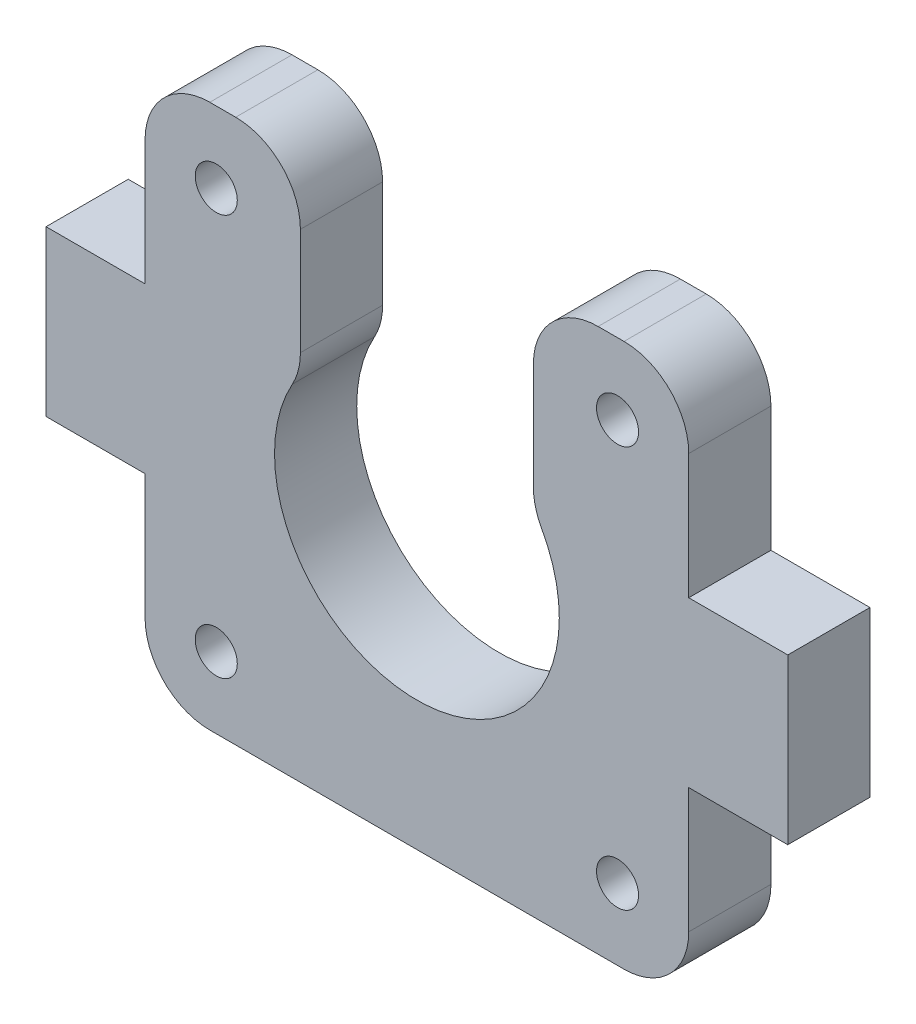
from build123d import *

# Parameters (mm, degrees)
SKETCH1_W                   = 57.3
SKETCH1_H                   = 42
BOSS_EXTRUDE1_DEPTH         = 6.35
TAP_DRILL_FOR_M3X0_5_TAP1_D = 3.25
CUT_EXTRUDE1_DEPTH          = 37.085246293
SKETCH5_W                   = 7.65
SKETCH5_H                   = 14.65
CUT_EXTRUDE2_DEPTH          = 37.085246293
FILLET1_R                   = 5


with BuildPart() as part:
    # Sketch1 → Boss-Extrude1 (new body)
    with BuildSketch(Plane.XY):
        Rectangle(SKETCH1_W, SKETCH1_H)
    extrude(amount=BOSS_EXTRUDE1_DEPTH)

    # Tap Drill for M3x0.5 Tap1 (through all)
    with Locations(Plane.XY.offset(6.35)):
        with Locations((15.5, 15.5), (15.5, -15.5), (-15.5, 15.5), (-15.5, -15.5)):
            Hole(TAP_DRILL_FOR_M3X0_5_TAP1_D / 2)

    # Sketch4 → Cut-Extrude1 (cut, through all)
    with BuildSketch(Plane.XY.offset(6.35)):
        with BuildLine():
            ThreePointArc((11, 0), (10.488088482, 3.31662479), (9, 6.32455532))
            Line((9, 6.32455532), (-9, 6.32455532))
            ThreePointArc((-9, 6.32455532), (-3.31662479, -10.488088482), (11, 0))
        make_face()
        with BuildLine():
            Line((-9, 6.32455532), (9, 6.32455532))
            ThreePointArc((9, 6.32455532), (0, 11), (-9, 6.32455532))
        make_face()
        with BuildLine():
            ThreePointArc((-9, 6.32455532), (0, 11), (9, 6.32455532))
            Line((9, 6.32455532), (9, 21))
            Line((9, 21), (-9, 21))
            Line((-9, 21), (-9, 6.32455532))
        make_face()
    extrude(amount=-CUT_EXTRUDE1_DEPTH, mode=Mode.SUBTRACT)

    # Sketch5 → Cut-Extrude2 (cut, through all)
    with BuildSketch(Plane.XY.offset(6.35)):
        with Locations((-24.825, 13.675)):
            Rectangle(SKETCH5_W, SKETCH5_H)
        with Locations((-24.825, -13.675)):
            Rectangle(SKETCH5_W, SKETCH5_H)
    cut_extrude2 = extrude(amount=-CUT_EXTRUDE2_DEPTH, mode=Mode.SUBTRACT)

    # Mirror1: Cut-Extrude2 across plane
    add(cut_extrude2.mirror(Plane(origin=(0, 0, 0), x_dir=(0, 0, 1), z_dir=(1, 0, 0))), mode=Mode.SUBTRACT)

    # Fillet1
    fillet1_edges = [part.edges().sort_by_distance(p)[0] for p in [
        (9, 6.32455532, 3.175),
        (-9, 6.32455532, 3.175),
        (-9, 21, 3.175),
        (9, 21, 3.175),
        (-21, 21, 3.175),
        (-21, -21, 3.175),
        (21, 21, 3.175),
        (21, -21, 3.175),
    ]]
    fillet(fillet1_edges, radius=FILLET1_R)


solid = part.part
